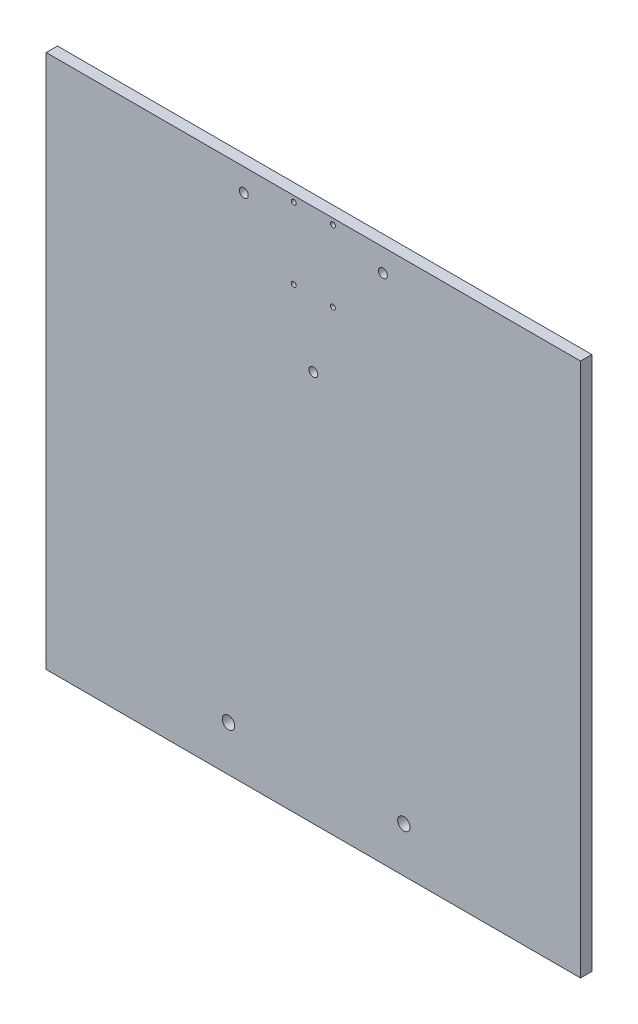
from build123d import *

# Parameters (mm, degrees)
SKETCH1_W           = 299.974
SKETCH1_H           = 299.974
BOSS_EXTRUDE1_DEPTH = 6.35
SKETCH3_R           = 1.375
CUT_EXTRUDE1_DEPTH  = 425.274821138
SKETCH4_R           = 2.5
CUT_EXTRUDE2_DEPTH  = 425.274821138
SKETCH5_R           = 3.4925
CUT_EXTRUDE3_DEPTH  = 425.274821138


with BuildPart() as part:
    # Sketch1 → Boss-Extrude1 (new body)
    with BuildSketch(Plane.XY):
        with Locations((149.987, -149.987)):
            Rectangle(SKETCH1_W, SKETCH1_H)
    extrude(amount=BOSS_EXTRUDE1_DEPTH)

    # Sketch3 → Cut-Extrude1 (cut, through all)
    with BuildSketch(Plane(origin=(0, 0, 0), x_dir=(-1, 0, 0), z_dir=(0, 0, -1))):
        with Locations((-160.987, -3.25)):
            Circle(SKETCH3_R)
        with Locations((-138.987, -3.25)):
            Circle(SKETCH3_R)
        with Locations((-138.987, -43.25)):
            Circle(SKETCH3_R)
        with Locations((-160.987, -43.25)):
            Circle(SKETCH3_R)
    extrude(amount=-CUT_EXTRUDE1_DEPTH, mode=Mode.SUBTRACT)

    # Sketch4 → Cut-Extrude2 (cut, through all)
    with BuildSketch(Plane(origin=(0, 0, 0), x_dir=(-1, 0, 0), z_dir=(0, 0, -1))):
        with Locations((-189.031549179, -12.707619021)):
            Circle(SKETCH4_R)
        with Locations((-110.942450821, -12.707619021)):
            Circle(SKETCH4_R)
        with Locations((-149.987, -80.334761958)):
            Circle(SKETCH4_R)
    extrude(amount=-CUT_EXTRUDE2_DEPTH, mode=Mode.SUBTRACT)

    # Sketch5 → Cut-Extrude3 (cut, through all)
    with BuildSketch(Plane.XY.offset(6.35)):
        with Locations((200.787, -274.574)):
            Circle(SKETCH5_R)
        with Locations((102.362, -274.574)):
            Circle(SKETCH5_R)
    extrude(amount=-CUT_EXTRUDE3_DEPTH, mode=Mode.SUBTRACT)


solid = part.part
